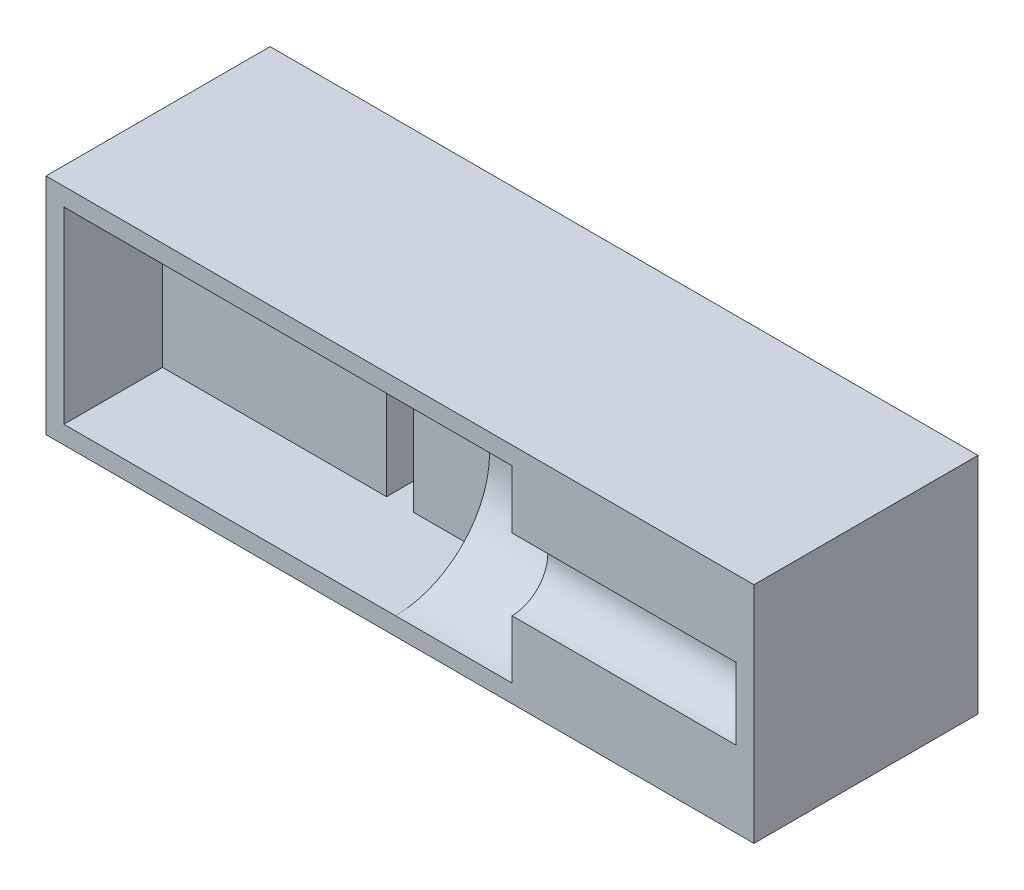
from build123d import *

# Parameters (mm, degrees)
SKETCH1_W           = 50
SKETCH1_H           = 25
BOSS_EXTRUDE1_DEPTH = 25
SKETCH2_W           = 37
SKETCH2_H           = 21
CUT_EXTRUDE1_DEPTH  = 11
SKETCH3_W           = 3
SKETCH3_H           = 21
CUT_EXTRUDE2_DEPTH  = 8
SKETCH7_W           = 25
SKETCH7_H           = 25
BOSS_EXTRUDE2_DEPTH = 19
CUT_EXTRUDE3_DEPTH  = 13
SKETCH10_W          = 25
SKETCH10_H          = 25
BOSS_EXTRUDE3_DEPTH = 10
CUT_EXTRUDE5_DEPTH  = 25


with BuildPart() as part:
    # Sketch1 → Boss-Extrude1 (new body)
    with BuildSketch(Plane.XY):
        with Locations((-5, 0)):
            Rectangle(SKETCH1_W, SKETCH1_H)
    extrude(amount=BOSS_EXTRUDE1_DEPTH)

    # Sketch2 → Cut-Extrude1 (cut)
    with BuildSketch(Plane.XY.offset(25)):
        with Locations((-9.5, 0)):
            Rectangle(SKETCH2_W, SKETCH2_H)
    extrude(amount=-CUT_EXTRUDE1_DEPTH, mode=Mode.SUBTRACT)

    # Sketch3 → Cut-Extrude2 (cut)
    with BuildSketch(Plane.XY.offset(14)):
        with Locations((-1.5, 0)):
            Rectangle(SKETCH3_W, SKETCH3_H)
    extrude(amount=-CUT_EXTRUDE2_DEPTH, mode=Mode.SUBTRACT)

    # Sketch7 → Boss-Extrude2 (add)
    with BuildSketch(Plane(origin=(20, 0, 0), x_dir=(0, 0, -1), z_dir=(1, 0, 0))):
        with Locations((-12.5, 0)):
            Rectangle(SKETCH7_W, SKETCH7_H)
    extrude(amount=BOSS_EXTRUDE2_DEPTH)

    # Sketch8 → Cut-Extrude3 (cut)
    with BuildSketch(Plane.ZY.offset(-9)):
        with BuildLine():
            Line((25, -10.5), (25, 10.5))
            ThreePointArc((25, 10.5), (14.5, 0), (25, -10.5))
        make_face()
    extrude(amount=-CUT_EXTRUDE3_DEPTH, mode=Mode.SUBTRACT)

    # Sketch10 → Boss-Extrude3 (add)
    with BuildSketch(Plane(origin=(39, 0, 0), x_dir=(0, 0, -1), z_dir=(1, 0, 0))):
        with Locations((-12.5, 0)):
            Rectangle(SKETCH10_W, SKETCH10_H)
    extrude(amount=BOSS_EXTRUDE3_DEPTH)

    # Sketch9 → Cut-Extrude5 (cut)
    with BuildSketch(Plane.ZY.offset(-22)):
        with BuildLine():
            Line((25, 4), (25, -4))
            ThreePointArc((25, -4), (21, 0), (25, 4))
        make_face()
    extrude(amount=-CUT_EXTRUDE5_DEPTH, mode=Mode.SUBTRACT)


solid = part.part
